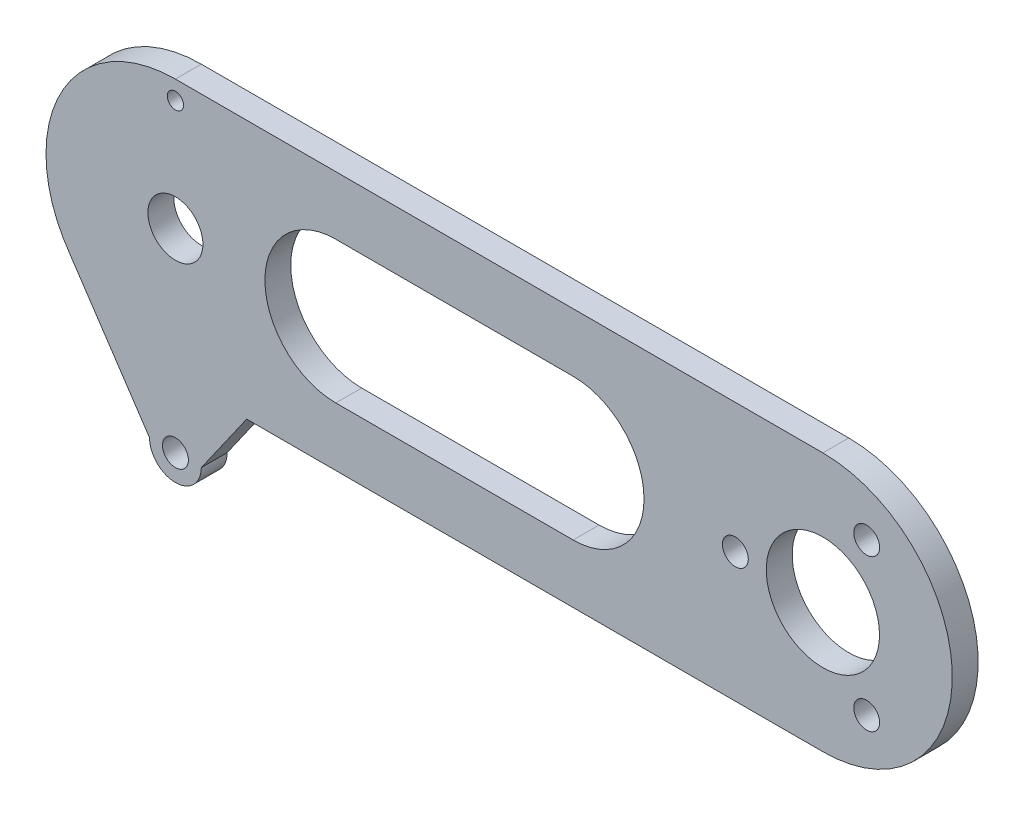
from build123d import *

# Parameters (mm, degrees)
SKETCH_1_R      = 4.25
SKETCH_1_R_2    = 8.75
SKETCH_1_R_3    = 2
SKETCH_1_R_4    = 1.25
EXTRUDE_1_DEPTH = 4


with BuildPart() as part:
    # 草图1 → 凸台-拉伸1 (new body)
    with BuildSketch(Plane.XY):
        with BuildLine():
            Line((-1, 20), (99.064295006, 20))
            ThreePointArc((99.064295006, 20), (119.064295006, 0), (99.064295006, -20))
            Line((99.064295006, -20), (10.014533743, -20))
            Line((10.014533743, -20), (3, -30))
            ThreePointArc((3, -30), (-1, -34), (-5, -30))
            Line((-5, -30), (-17.208156126, -11.717323713))
            ThreePointArc((-17.208156126, -11.717323713), (-18.809358134, 9.10092099), (-1, 20))
        make_face()
        with Locations((-1, 0)):
            Circle(SKETCH_1_R, mode=Mode.SUBTRACT)
        with Locations((99.064295006, 0)):
            Circle(SKETCH_1_R_2, mode=Mode.SUBTRACT)
        with Locations((85.534295006, 0)):
            Circle(SKETCH_1_R_3, mode=Mode.SUBTRACT)
        with Locations((105.829295006, 11.717323713)):
            Circle(SKETCH_1_R_3, mode=Mode.SUBTRACT)
        with Locations((105.829295006, -11.717323713)):
            Circle(SKETCH_1_R_3, mode=Mode.SUBTRACT)
        with Locations((-1, -30)):
            Circle(SKETCH_1_R_3, mode=Mode.SUBTRACT)
        with Locations((-1, 17.12)):
            Circle(SKETCH_1_R_4, mode=Mode.SUBTRACT)
        with BuildLine():
            Line((23.78352134, 10.95385289), (60.46647866, 10.95385289))
            ThreePointArc((60.46647866, 10.95385289), (71.420331549, 0), (60.46647866, -10.95385289))
            Line((60.46647866, -10.95385289), (23.78352134, -10.95385289))
            ThreePointArc((23.78352134, -10.95385289), (12.829668451, 0), (23.78352134, 10.95385289))
        make_face(mode=Mode.SUBTRACT)
    extrude(amount=EXTRUDE_1_DEPTH)


solid = part.part
